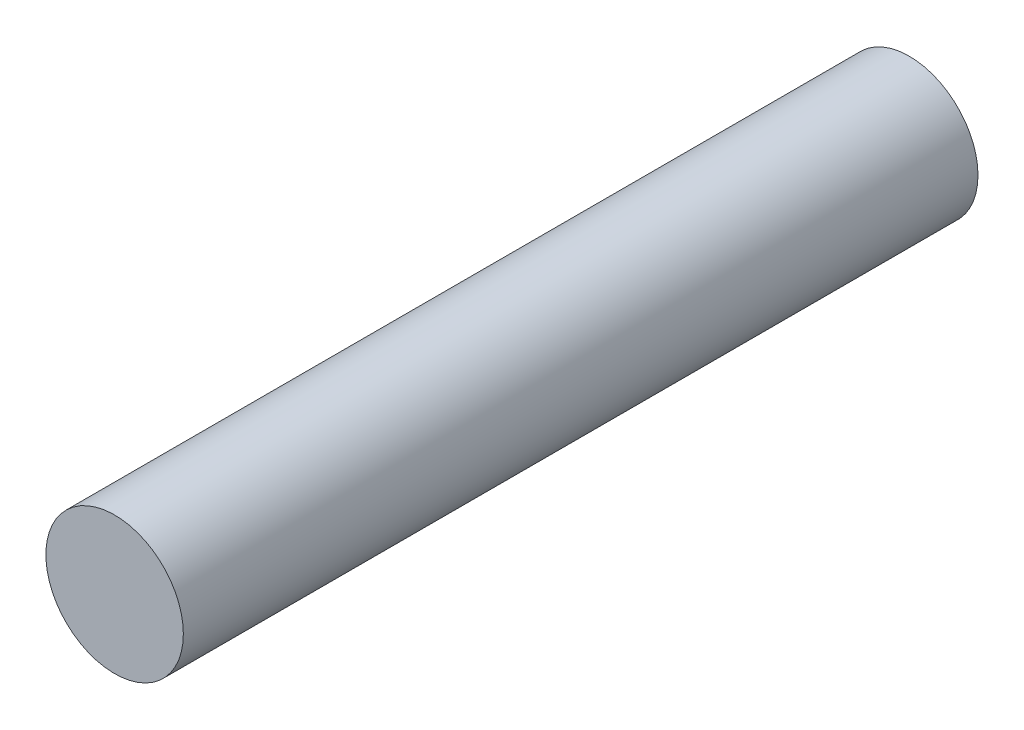
from build123d import *

# Parameters (mm, degrees)
EXTRUDE_1_DEPTH      = 9
EXTRUDE_1_DEPTH_BACK = 38
SKETCH_1_R           = 4.065381732


with BuildPart() as part:
    # 草图1 → 凸台-拉伸1 (new, two sides: drawn at the far end of the back side and taken through both)
    with BuildSketch(Plane.XY.offset(-EXTRUDE_1_DEPTH_BACK)):
        with Locations((-39.890553187, 50.738604847)):
            Circle(SKETCH_1_R)
    extrude(amount=EXTRUDE_1_DEPTH + EXTRUDE_1_DEPTH_BACK)


solid = part.part
